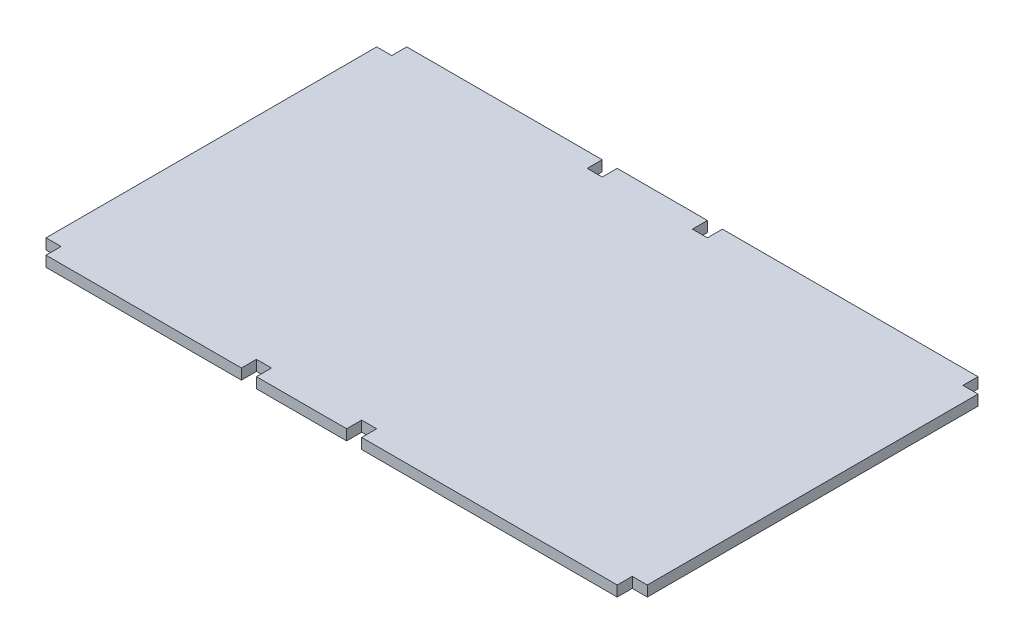
from build123d import *

# Parameters (mm, degrees)
BOSS_EXTRUDE1_DEPTH = 17.78


with BuildPart() as part:
    # Sketch1 → Boss-Extrude1 (new body)
    with BuildSketch(Plane(origin=(0, 0, 0), x_dir=(1, 0, 0), z_dir=(0, 1, 0))):
        Polygon((-660.4, 609.6), (-990.6, 609.6), (-990.6, 584.2), (-1016, 584.2), (-1016, 25.4), (-990.6, 25.4), (-990.6, 0), (-660.4, 0), (-660.4, 25.4), (-635, 25.4), (-635, 0), (-482.584026574, 0), (-482.584026574, 25.4), (-457.184026574, 25.4), (-457.184026574, 0), (-25.4, 0), (-25.4, 25.4), (0, 25.4), (0, 584.2), (-25.4, 584.2), (-25.4, 609.6), (-457.184026574, 609.6), (-457.184026574, 584.2), (-482.584026574, 584.2), (-482.584026574, 609.6), (-635, 609.6), (-635, 584.2), (-660.4, 584.2), align=None)
    extrude(amount=BOSS_EXTRUDE1_DEPTH)


solid = part.part
